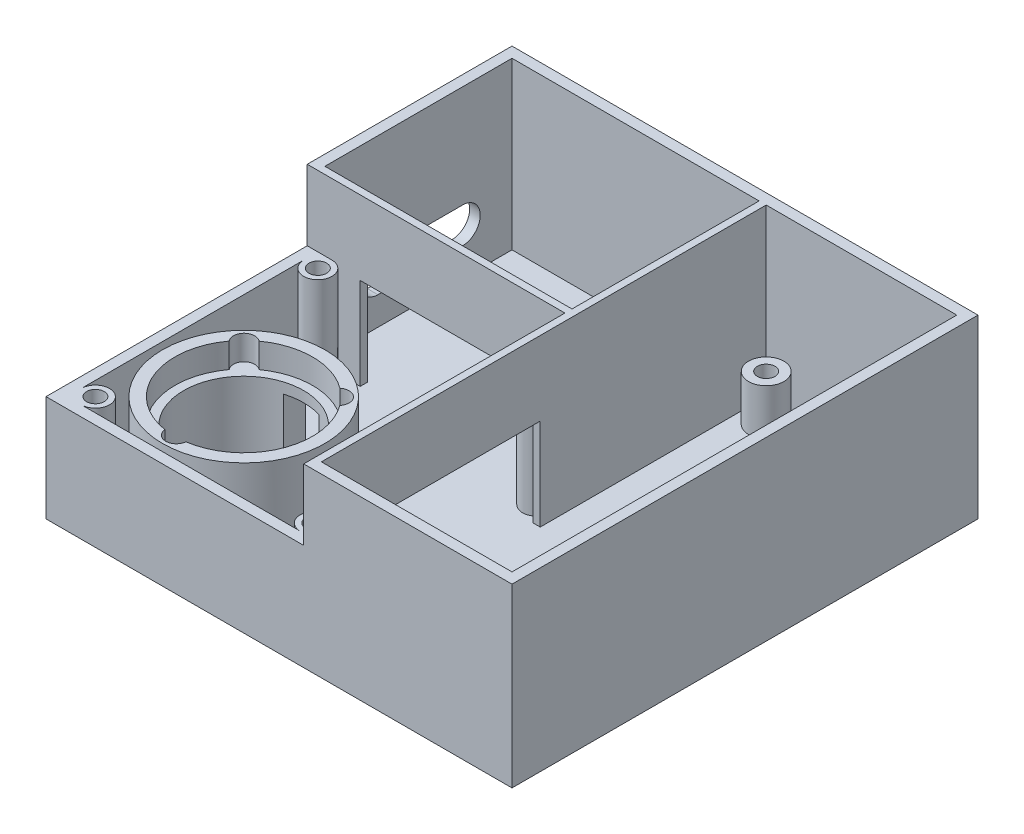
from build123d import *

# Parameters (mm, degrees)
SKETCH_223_R             = 11.5
SKETCH_223_R_2           = 8.5
EXTRUDE_6_DEPTH          = 11.5
SKETCH_7_R               = 11.5
EXTRUDE_7_DEPTH          = 15
CUT_EXTRUDE_1_REACH      = 36.373
CUT_EXTRUDE_1_END_RADIUS = 11.5
SKETCH_4_W               = 5
SKETCH_4_H               = 10
SKETCH_1_W               = 35
SKETCH_1_H               = 26.5
SKETCH_1_W_2             = 27
SKETCH_1_H_2             = 63
SKETCH_1_R               = 2.5
EXTRUDE_8_DEPTH          = 1.5
SKETCH_1_5_W             = 27
SKETCH_1_5_H             = 63
SKETCH_1_5_W_2           = 35
SKETCH_1_5_H_2           = 26.5
EXTRUDE_9_DEPTH          = 25
SKETCH_1_6_R             = 2.5
SKETCH_1_6_R_2           = 1.25
EXTRUDE_10_DEPTH         = 8
EXTRUDE_11_DEPTH         = 15
SKETCH_1_9_R             = 2
SKETCH_1_9_R_2           = 1.25
EXTRUDE_22_DEPTH         = 15
CUT_EXTRUDE_2_REACH      = 81.456
SKETCH_5_W               = 28
SKETCH_5_H               = 13
CUT_EXTRUDE_3_REACH      = 81.687
SKETCH_6_W               = 25
SKETCH_6_H               = 13
CUT_EXTRUDE_4_REACH      = 98.628


with BuildPart() as part:
    # Sketch 223 → 凸台-拉伸6 (new body)
    with BuildSketch(Plane(origin=(0, 0, 0), x_dir=(1, 0, 0), z_dir=(0, 1, 0))):
        with Locations(Location((14, 14, 0), (0, 0, 270))):
            Circle(SKETCH_223_R)
        with Locations(Location((14, 14, 0), (0, 0, 270))):
            Circle(SKETCH_223_R_2, mode=Mode.SUBTRACT)
    extrude(amount=EXTRUDE_6_DEPTH)

    # Sketch 7 → 凸台-拉伸7 (add)
    with BuildSketch(Plane(origin=(0, 0, 0), x_dir=(1, 0, 0), z_dir=(0, 1, 0))):
        with Locations(Location((14, 14, 0), (0, 0, 270))):
            Circle(SKETCH_7_R)
        with BuildLine():
            ThreePointArc((21.892872757, 19.724077187), (23.274103983, 17.008902675), (23.75, 14))
            ThreePointArc((23.75, 14), (21.390430568, 7.640437435), (15.453787483, 4.358993727))
            ThreePointArc((15.453787483, 4.358993727), (13.954467258, 3.002614207), (12.466429945, 4.371362356))
            ThreePointArc((12.466429945, 4.371362356), (4.976803671, 10.306163512), (6.1547961, 19.789237926))
            ThreePointArc((6.1547961, 19.789237926), (6.255870441, 21.80852258), (8.275922813, 21.892872757))
            ThreePointArc((8.275922813, 21.892872757), (14.040367815, 23.749916432), (19.789237926, 21.8452039))
            ThreePointArc((19.789237926, 21.8452039), (21.80852258, 21.744129559), (21.892872757, 19.724077187))
        make_face(mode=Mode.SUBTRACT)
    extrude(amount=EXTRUDE_7_DEPTH)

    # 切除-拉伸1: up to this cylinder (the profile starts inside it)
    cut_extrude_1_end = Plane(origin=(14, 5, -14), z_dir=(0, -1, 0)) * Cylinder(CUT_EXTRUDE_1_END_RADIUS, 96.746, mode=Mode.PRIVATE)
    # 草图4 → 切除-拉伸1 (cut, up to the surface)
    with BuildSketch(Plane.XY.offset(-20), mode=Mode.PRIVATE) as cut_extrude_1_sk1:
        with Locations((14.03258037, 5)):
            Rectangle(SKETCH_4_W, SKETCH_4_H)
    cut_extrude_1_tool1 = extrude(cut_extrude_1_sk1.sketch, amount=-CUT_EXTRUDE_1_REACH, mode=Mode.PRIVATE) & cut_extrude_1_end
    add(cut_extrude_1_tool1.solids().sort_by_distance((14.03258, 5, -20))[0], mode=Mode.SUBTRACT)

    # 草图1 → 凸台-拉伸8 (add)
    # profile 1 of 3: a face of its own
    with BuildSketch(Plane(origin=(0, 0, 0), x_dir=(1, 0, 0), z_dir=(0, 1, 0))):
        with Locations((19, 51.25)):
            Rectangle(SKETCH_1_W, SKETCH_1_H)
    # profile 2 of 3: a face of its own
    with BuildSketch(Plane(origin=(0, 0, 0), x_dir=(1, 0, 0), z_dir=(0, 1, 0))):
        with BuildLine():
            ThreePointArc((3.5, 37), (4.914213562, 33.585786438), (1.5, 35))
            Line((1.5, 35), (1.5, 3.5))
            ThreePointArc((1.5, 3.5), (4.914213562, 4.914213562), (3.5, 1.5))
            Line((3.5, 1.5), (34.5, 1.5))
            ThreePointArc((34.5, 1.5), (33.085786438, 4.914213562), (36.5, 3.5))
            Line((36.5, 3.5), (36.5, 35))
            ThreePointArc((36.5, 35), (33.085786438, 33.585786438), (34.5, 37))
            Line((34.5, 37), (3.5, 37))
        make_face()
    # profile 3 of 3: a face of its own
    with BuildSketch(Plane(origin=(0, 0, 0), x_dir=(1, 0, 0), z_dir=(0, 1, 0))):
        with Locations((51, 33)):
            Rectangle(SKETCH_1_W_2, SKETCH_1_H_2)
        with Locations(Location((40.9, 15.6, 0), (0, 0, 270))):
            Circle(SKETCH_1_R, mode=Mode.SUBTRACT)
        with Locations(Location((61.1, 15.6, 0), (0, 0, 270))):
            Circle(SKETCH_1_R, mode=Mode.SUBTRACT)
        with Locations(Location((40.9, 61.1, 0), (0, 0, 270))):
            Circle(SKETCH_1_R, mode=Mode.SUBTRACT)
        with Locations(Location((61.1, 61.1, 0), (0, 0, 270))):
            Circle(SKETCH_1_R, mode=Mode.SUBTRACT)
    extrude(amount=EXTRUDE_8_DEPTH)


with BuildPart() as extrude_8_piece_1:
    # of the separate pieces the step leaves, piece 1, a body of its own (extrude_8_pieces)
    add(part.part.solids().sort_by_distance((14, 15, -2.5))[0])



with BuildPart() as extrude_8_piece_2:
    # of the separate pieces the step leaves, piece 2, a body of its own (extrude_8_pieces)
    add(part.part.solids().sort_by_distance((37.5, 0, -1.5))[0])



with BuildPart() as extrude_8_piece_3:
    # of the separate pieces the step leaves, piece 3, a body of its own (extrude_8_pieces)
    add(part.part.solids().sort_by_distance((1.5, 0, -64.5))[0])


with BuildPart() as extrude_8_piece_2_1:
    add(extrude_8_piece_2.part)

    add(extrude_8_piece_3.part)  # 凸台-拉伸9 merges 凸台-拉伸8 piece 3
    # 草图1<5> → 凸台-拉伸9 (add)
    with BuildSketch(Plane(origin=(0, 0, 0), x_dir=(1, 0, 0), z_dir=(0, 1, 0))):
        Polygon((0, 37), (36.5, 37), (36.5, 0), (66, 0), (66, 66), (0, 66), align=None)
        with Locations((51, 33)):
            Rectangle(SKETCH_1_5_W, SKETCH_1_5_H, mode=Mode.SUBTRACT)
        with Locations((19, 51.25)):
            Rectangle(SKETCH_1_5_W_2, SKETCH_1_5_H_2, mode=Mode.SUBTRACT)
    extrude(amount=EXTRUDE_9_DEPTH)

    # 草图1<6> → 凸台-拉伸10 (add)
    # profile 1 of 4: a face of its own
    with BuildSketch(Plane(origin=(0, 0, 0), x_dir=(1, 0, 0), z_dir=(0, 1, 0))):
        with Locations(Location((61.1, 61.1, 0), (0, 0, 270))):
            Circle(SKETCH_1_6_R)
        with Locations(Location((61.1, 61.1, 0), (0, 0, 270))):
            Circle(SKETCH_1_6_R_2, mode=Mode.SUBTRACT)
    # profile 2 of 4: a face of its own
    with BuildSketch(Plane(origin=(0, 0, 0), x_dir=(1, 0, 0), z_dir=(0, 1, 0))):
        with Locations(Location((40.9, 61.1, 0), (0, 0, 270))):
            Circle(SKETCH_1_6_R)
        with Locations(Location((40.9, 61.1, 0), (0, 0, 270))):
            Circle(SKETCH_1_6_R_2, mode=Mode.SUBTRACT)
    # profile 3 of 4: a face of its own
    with BuildSketch(Plane(origin=(0, 0, 0), x_dir=(1, 0, 0), z_dir=(0, 1, 0))):
        with Locations(Location((40.9, 15.6, 0), (0, 0, 270))):
            Circle(SKETCH_1_6_R)
        with Locations(Location((40.9, 15.6, 0), (0, 0, 270))):
            Circle(SKETCH_1_6_R_2, mode=Mode.SUBTRACT)
    # profile 4 of 4: a face of its own
    with BuildSketch(Plane(origin=(0, 0, 0), x_dir=(1, 0, 0), z_dir=(0, 1, 0))):
        with Locations(Location((61.1, 15.6, 0), (0, 0, 270))):
            Circle(SKETCH_1_6_R)
        with Locations(Location((61.1, 15.6, 0), (0, 0, 270))):
            Circle(SKETCH_1_6_R_2, mode=Mode.SUBTRACT)
    extrude(amount=EXTRUDE_10_DEPTH)


with BuildPart() as extrude_8_piece_1_1:
    add(extrude_8_piece_1.part)

    add(extrude_8_piece_2_1.part)  # 凸台-拉伸11 merges 凸台-拉伸8 piece 2
    # 草图1<7> → 凸台-拉伸11 (add)
    with BuildSketch(Plane(origin=(0, 0, 0), x_dir=(1, 0, 0), z_dir=(0, 1, 0))):
        Polygon((1.5, 35), (1.5, 37), (0, 37), (0, 0), (36.5, 0), (36.5, 1.5), (34.5, 1.5), (3.5, 1.5), (1.5, 1.5), (1.5, 3.5), align=None)
    extrude(amount=EXTRUDE_11_DEPTH)

    # 草图1<9> → 凸台-拉伸22 (add)
    # profile 1 of 8: a face of its own
    with BuildSketch(Plane(origin=(0, 0, 0), x_dir=(1, 0, 0), z_dir=(0, 1, 0))):
        with Locations((3.5, 3.5)):
            Circle(SKETCH_1_9_R)
        with Locations(Location((3.5, 3.5, 0), (0, 0, 270))):
            Circle(SKETCH_1_9_R_2, mode=Mode.SUBTRACT)
    # profile 2 of 8: a face of its own
    with BuildSketch(Plane(origin=(0, 0, 0), x_dir=(1, 0, 0), z_dir=(0, 1, 0))):
        with BuildLine():
            ThreePointArc((3.5, 1.5), (2.085786438, 2.085786438), (1.5, 3.5))
            Line((1.5, 3.5), (1.5, 1.5))
            Line((1.5, 1.5), (3.5, 1.5))
        make_face()
    # profile 3 of 8: a face of its own
    with BuildSketch(Plane(origin=(0, 0, 0), x_dir=(1, 0, 0), z_dir=(0, 1, 0))):
        with Locations((34.5, 3.5)):
            Circle(SKETCH_1_9_R)
        with Locations(Location((34.5, 3.5, 0), (0, 0, 270))):
            Circle(SKETCH_1_9_R_2, mode=Mode.SUBTRACT)
    # profile 4 of 8: a face of its own
    with BuildSketch(Plane(origin=(0, 0, 0), x_dir=(1, 0, 0), z_dir=(0, 1, 0))):
        with BuildLine():
            ThreePointArc((36.5, 3.5), (35.914213562, 2.085786438), (34.5, 1.5))
            Line((34.5, 1.5), (36.5, 1.5))
            Line((36.5, 1.5), (36.5, 3.5))
        make_face()
    # profile 5 of 8: a face of its own
    with BuildSketch(Plane(origin=(0, 0, 0), x_dir=(1, 0, 0), z_dir=(0, 1, 0))):
        with Locations((34.5, 35)):
            Circle(SKETCH_1_9_R)
        with Locations(Location((34.5, 35, 0), (0, 0, 270))):
            Circle(SKETCH_1_9_R_2, mode=Mode.SUBTRACT)
    # profile 6 of 8: a face of its own
    with BuildSketch(Plane(origin=(0, 0, 0), x_dir=(1, 0, 0), z_dir=(0, 1, 0))):
        with BuildLine():
            Line((36.5, 37), (34.5, 37))
            ThreePointArc((34.5, 37), (35.914213562, 36.414213562), (36.5, 35))
            Line((36.5, 35), (36.5, 37))
        make_face()
    # profile 7 of 8: a face of its own
    with BuildSketch(Plane(origin=(0, 0, 0), x_dir=(1, 0, 0), z_dir=(0, 1, 0))):
        with Locations((3.5, 35)):
            Circle(SKETCH_1_9_R)
        with Locations(Location((3.5, 35, 0), (0, 0, 270))):
            Circle(SKETCH_1_9_R_2, mode=Mode.SUBTRACT)
    # profile 8 of 8: a face of its own
    with BuildSketch(Plane(origin=(0, 0, 0), x_dir=(1, 0, 0), z_dir=(0, 1, 0))):
        with BuildLine():
            Line((3.5, 37), (1.5, 37))
            Line((1.5, 37), (1.5, 35))
            ThreePointArc((1.5, 35), (2.085786438, 36.414213562), (3.5, 37))
        make_face()
    extrude(amount=EXTRUDE_22_DEPTH)

    # 草图5 → 切除-拉伸2 (cut, up to next)
    with BuildSketch(Plane.ZY.offset(-36.5), mode=Mode.PRIVATE) as cut_extrude_2_sk1:
        with Locations((-18.5, 8)):
            Rectangle(SKETCH_5_W, SKETCH_5_H)
    cut_extrude_2_tool1 = extrude(cut_extrude_2_sk1.sketch, amount=-CUT_EXTRUDE_2_REACH, mode=Mode.PRIVATE) & extrude_8_piece_1_1.part
    add(cut_extrude_2_tool1.solids().sort_by_distance((36.5, 8, -18.5))[0], mode=Mode.SUBTRACT)

    # 草图6 → 切除-拉伸3 (cut, up to next)
    with BuildSketch(Plane.XY.offset(-37), mode=Mode.PRIVATE) as cut_extrude_3_sk1:
        with Locations((20, 8)):
            Rectangle(SKETCH_6_W, SKETCH_6_H)
    cut_extrude_3_tool1 = extrude(cut_extrude_3_sk1.sketch, amount=-CUT_EXTRUDE_3_REACH, mode=Mode.PRIVATE) & extrude_8_piece_1_1.part
    add(cut_extrude_3_tool1.solids().sort_by_distance((20, 8, -37))[0], mode=Mode.SUBTRACT)

    # Sketch 7 2 → 切除-拉伸4 (cut, up to next)
    with BuildSketch(Plane.ZY, mode=Mode.PRIVATE) as cut_extrude_4_sk1:
        with BuildLine():
            Line((-57.5, 10.5), (-45.5, 10.5))
            ThreePointArc((-45.5, 10.5), (-43, 8), (-45.5, 5.5))
            Line((-45.5, 5.5), (-57.5, 5.5))
            ThreePointArc((-57.5, 5.5), (-60, 8), (-57.5, 10.5))
        make_face()
    cut_extrude_4_tool1 = extrude(cut_extrude_4_sk1.sketch, amount=-CUT_EXTRUDE_4_REACH, mode=Mode.PRIVATE) & extrude_8_piece_1_1.part
    add(cut_extrude_4_tool1.solids().sort_by_distance((0, 8, -51.5))[0], mode=Mode.SUBTRACT)


solid = extrude_8_piece_1_1.part
